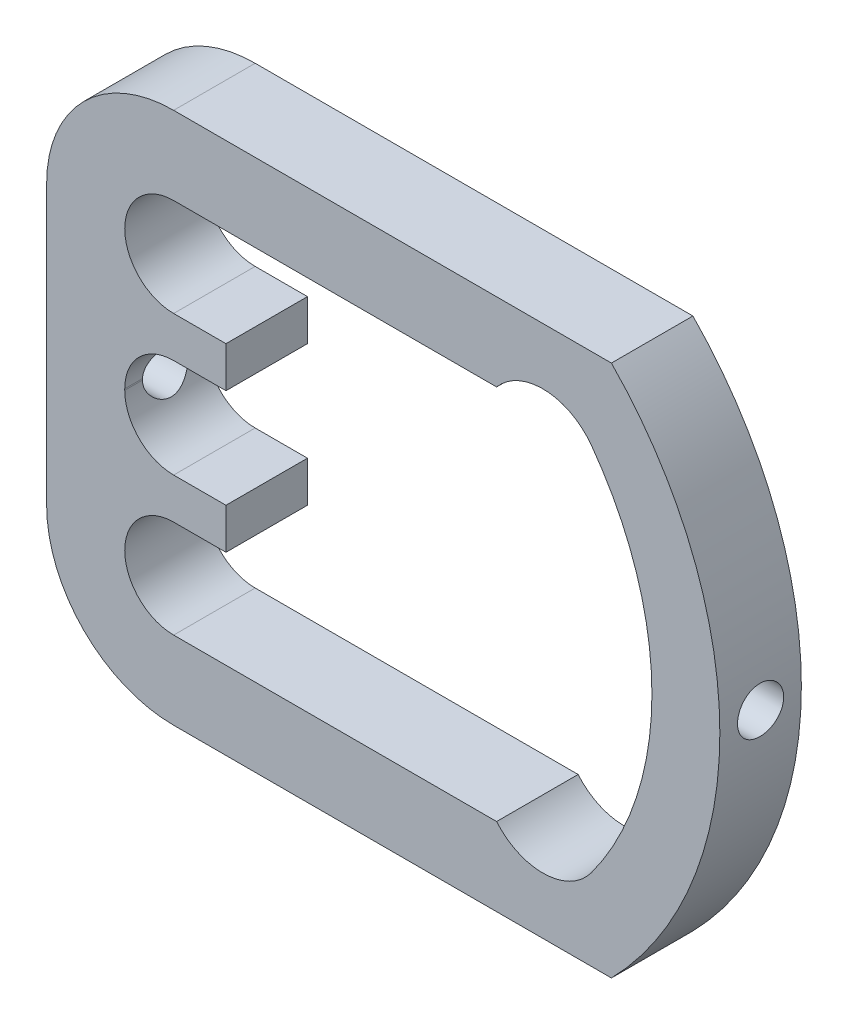
from build123d import *

# Parameters (mm, degrees)
EXTRUDE_1_DEPTH          = 6
CUT_EXTRUDE_1_DEPTH      = 35.74465435
CUT_EXTRUDE_1_DEPTH_BACK = 35.74465435
SKETCH_2_R               = 1.7


with BuildPart() as part:
    # 草图1 → 凸台-拉伸1 (new body)
    with BuildSketch(Plane.XY):
        with BuildLine():
            Line((20.071646816, 19.6), (-12.15, 19.6))
            ThreePointArc((-12.15, 19.6), (-18.761448404, 16.861448404), (-21.5, 10.25))
            Line((-21.5, 10.25), (-21.5, -10.25))
            ThreePointArc((-21.5, -10.25), (-18.761448404, -16.861448404), (-12.15, -19.6))
            Line((-12.15, -19.6), (20.071646816, -19.6))
            ThreePointArc((20.071646816, -19.6), (28.054072893, 0), (20.071646816, 19.6))
        make_face()
        with BuildLine():
            ThreePointArc((11.6217341, 13.850243366), (15.167616283, 15.432881266), (18.601156804, 13.619370123))
            ThreePointArc((18.601156804, 13.619370123), (23.054072893, 0), (18.601156804, -13.619370123))
            ThreePointArc((18.601156804, -13.619370123), (15.167616283, -15.432881266), (11.6217341, -13.850243366))
            Line((11.6217341, -13.850243366), (-12.15, -13.850243366))
            ThreePointArc((-12.15, -13.850243366), (-15.750243366, -10.25), (-12.15, -6.649756634))
            Line((-12.15, -6.649756634), (-8.3, -6.649756634))
            Line((-8.3, -6.649756634), (-8.3, -3.649756634))
            Line((-8.3, -3.649756634), (-12.15, -3.649756634))
            ThreePointArc((-12.15, -3.649756634), (-14.695756498, -2.595269766), (-15.750243366, -0.049513268))
            Line((-15.750243366, -0.049513268), (-15.750243366, 0.049513268))
            ThreePointArc((-15.750243366, 0.049513268), (-14.695756498, 2.595269766), (-12.15, 3.649756634))
            Line((-12.15, 3.649756634), (-8.3, 3.649756634))
            Line((-8.3, 3.649756634), (-8.3, 6.649756634))
            Line((-8.3, 6.649756634), (-12.15, 6.649756634))
            ThreePointArc((-12.15, 6.649756634), (-15.750243366, 10.25), (-12.15, 13.850243366))
            Line((-12.15, 13.850243366), (11.6217341, 13.850243366))
        make_face(mode=Mode.SUBTRACT)
    extrude(amount=EXTRUDE_1_DEPTH)

    # 草图2 → 切除-拉伸1 (cut, two sides: drawn at the far end of the back side and taken through both)
    with BuildSketch(Plane(origin=(0, 0, 0), x_dir=(0, 0, -1), z_dir=(1, 0, 0)).offset(-CUT_EXTRUDE_1_DEPTH_BACK)):
        with Locations((-3, -0.049513268)):
            Circle(SKETCH_2_R)
    extrude(amount=CUT_EXTRUDE_1_DEPTH + CUT_EXTRUDE_1_DEPTH_BACK, mode=Mode.SUBTRACT)


solid = part.part
